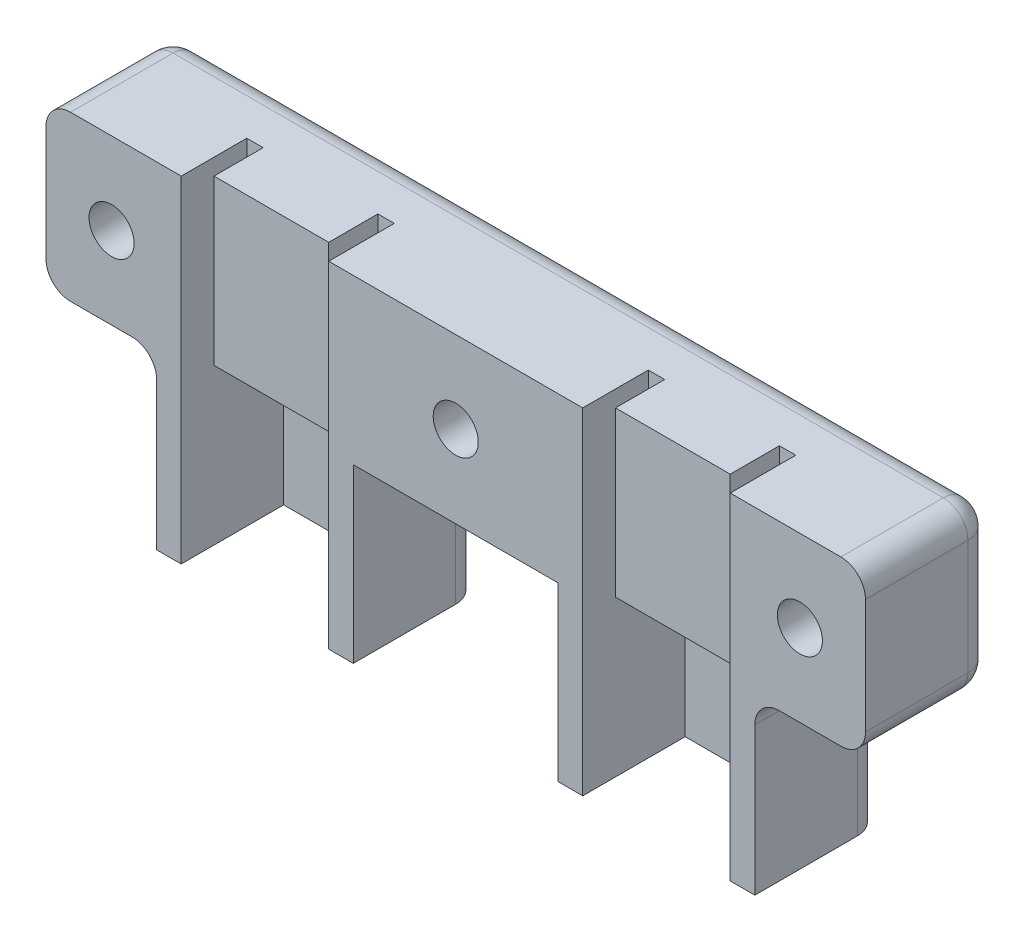
from build123d import *

# Parameters (mm, degrees)
BOSS_EXTRUDE1_DEPTH = 20
EXTRUDE_THIN3_DEPTH = 21
SKETCH3_R           = 2.75
CUT_EXTRUDE1_DEPTH  = 73.35515227
FILLET2_R           = 3


with BuildPart() as part:
    # Sketch1 → Boss-Extrude1 (new body)
    with BuildSketch(Plane(origin=(0, 0, 0), x_dir=(1, 0, 0), z_dir=(0, 1, 0))):
        Polygon((-32.516534914, -1.83981797), (-32.516534914, 13.66018203), (67.483465086, 13.66018203), (67.483465086, -1.83981797), (50.983465086, -1.83981797), (50.983465086, 1.63642231), (50.983465086, 6.16018203), (48.983465086, 6.16018203), (48.983465086, 0.16018203), (34.983465086, 0.16018203), (34.983465086, 6.16018203), (32.983465086, 6.16018203), (32.983465086, 1.63642231), (32.983465086, -1.83981797), (1.983465086, -1.83981797), (1.983465086, 1.63642231), (1.983465086, 6.16018203), (-0.016534914, 6.16018203), (-0.016534914, 0.16018203), (-14.016534914, 0.16018203), (-14.016534914, 6.16018203), (-16.016534914, 6.16018203), (-16.016534914, 1.63642231), (-16.016534914, -1.83981797), align=None)
    extrude(amount=BOSS_EXTRUDE1_DEPTH)

    # Sketch2 → Extrude-Thin3 (add)
    with BuildSketch(Plane.XZ):
        Polygon((-19.016534914, 1.83981797), (-19.016534914, -13.66018203), (4.983465086, -13.66018203), (4.983465086, 1.83981797), (1.983465086, 1.83981797), (1.983465086, -10.66018203), (-16.016534914, -10.66018203), (-16.016534914, 1.83981797), align=None)
        Polygon((50.983465086, 1.83981797), (50.983465086, -10.66018203), (32.983465086, -10.66018203), (32.983465086, 1.83981797), (29.983465086, 1.83981797), (29.983465086, -13.66018203), (53.983465086, -13.66018203), (53.983465086, 1.83981797), align=None)
    extrude(amount=EXTRUDE_THIN3_DEPTH)

    # Sketch3 → Cut-Extrude1 (cut, through all)
    with BuildSketch(Plane(origin=(0, 0, -13.66018203), x_dir=(-1, 0, 0), z_dir=(0, 0, -1))):
        with Locations((24.516534914, 10)):
            Circle(SKETCH3_R)
        with Locations((-59.483465086, 10)):
            Circle(SKETCH3_R)
        with Locations((-17.483465086, 10)):
            Circle(SKETCH3_R)
    extrude(amount=-CUT_EXTRUDE1_DEPTH, mode=Mode.SUBTRACT)

    # Fillet2
    fillet2_edges = [part.edges().sort_by_distance(p)[0] for p in [
        (17.483465086, 0, -13.66018203),
        (29.983465086, -10.5, -13.66018203),
        (53.983465086, -10.5, -13.66018203),
        (60.733465086, 0, -13.66018203),
        (67.483465086, 0, -5.91018203),
        (67.483465086, 10, -13.66018203),
        (67.483465086, 20, -5.91018203),
        (17.483465086, 20, -13.66018203),
        (-32.516534914, 20, -5.91018203),
        (-32.516534914, 0, -5.91018203),
        (-19.016534914, 0, -5.91018203),
        (4.983465086, -10.5, -13.66018203),
        (-19.016534914, -10.5, -13.66018203),
        (-25.766534914, 0, -13.66018203),
        (-32.516534914, 10, -13.66018203),
        (53.983465086, 0, -5.91018203),
    ]]
    fillet(fillet2_edges, radius=FILLET2_R)


solid = part.part
